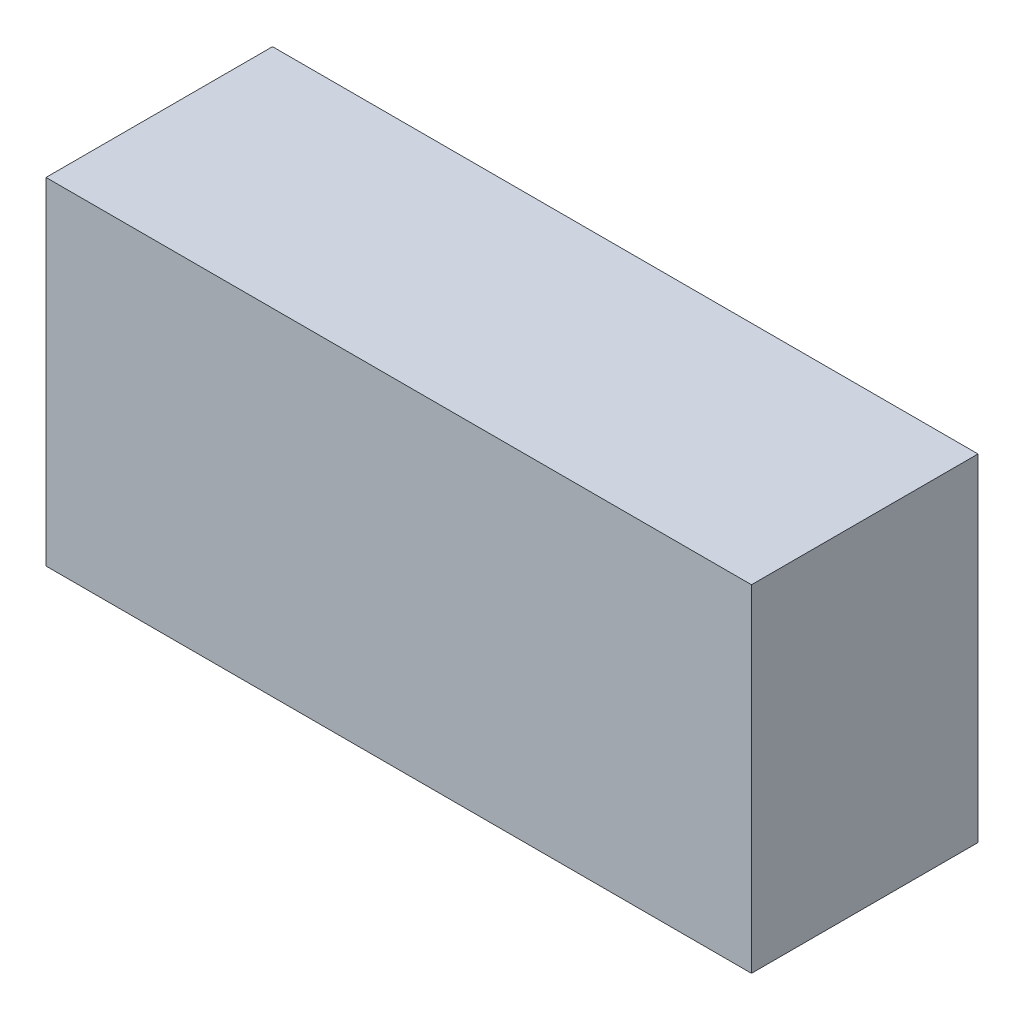
from build123d import *

# Parameters (mm, degrees)
SKETCH_1_W      = 109
SKETCH_1_H      = 35
EXTRUDE_1_DEPTH = 52


with BuildPart() as part:
    # 草图1 → 凸台-拉伸1 (new body)
    with BuildSketch(Plane(origin=(0, 0, 0), x_dir=(1, 0, 0), z_dir=(0, 1, 0))):
        with Locations((54.5, 17.5)):
            Rectangle(SKETCH_1_W, SKETCH_1_H)
    extrude(amount=EXTRUDE_1_DEPTH)


solid = part.part
